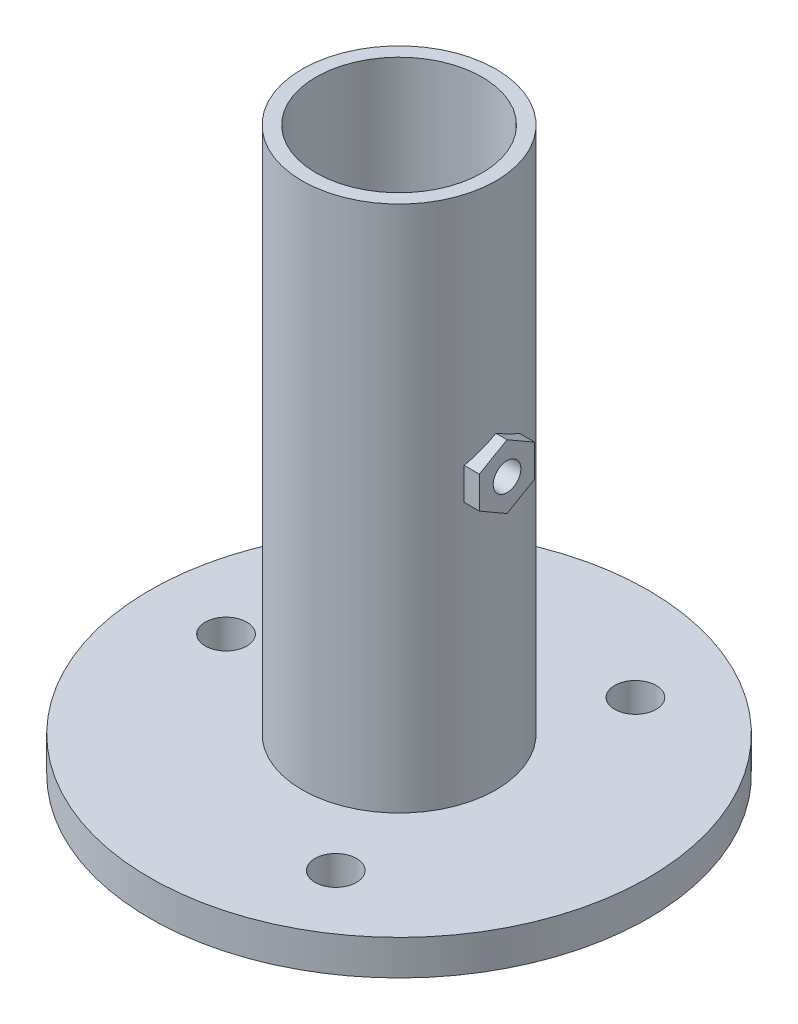
from build123d import *

# Parameters (mm, degrees)
SKETCH2_R                = 17.5
BOSS_EXTRUDE2_DEPTH      = 101.6
SKETCH3_R                = 45
BOSS_EXTRUDE3_DEPTH      = 6.35
SKETCH4_R                = 9
CUT_EXTRUDE1_DEPTH       = 95.25
SKETCH5_R                = 14.999999972
CUT_EXTRUDE2_DEPTH       = 96.6
SKETCH6_R                = 2.5
CUT_EXTRUDE3_DEPTH       = 120.885612148
BOSS_EXTRUDE4_DEPTH      = 5
BOSS_EXTRUDE4_DEPTH_BACK = 2
SKETCH8_R                = 2.5
SKETCH9_R                = 3.75
CUT_EXTRUDE4_DEPTH       = 115.553753758
CIRPATTERN1_COUNT        = 3


with BuildPart() as part:
    # Sketch2 → Boss-Extrude2 (new body)
    with BuildSketch(Plane(origin=(0, 0, 0), x_dir=(1, 0, 0), z_dir=(0, 1, 0))):
        with Locations(Location((0, 0, 0), (0, 0, 270))):
            Circle(SKETCH2_R)
    extrude(amount=BOSS_EXTRUDE2_DEPTH)

    # Sketch3 → Boss-Extrude3 (add)
    with BuildSketch(Plane(origin=(0, 0, 0), x_dir=(-1, 0, 0), z_dir=(0, -1, 0))):
        with Locations(Location((0, 0, 0), (0, 0, 90))):
            Circle(SKETCH3_R)
    extrude(amount=-BOSS_EXTRUDE3_DEPTH)

    # Sketch4 → Cut-Extrude1 (cut)
    with BuildSketch(Plane(origin=(0, 0, 0), x_dir=(-1, 0, 0), z_dir=(0, -1, 0))):
        with Locations(Location((0, 0, 0), (0, 0, 90))):
            Circle(SKETCH4_R)
    extrude(amount=-CUT_EXTRUDE1_DEPTH, mode=Mode.SUBTRACT)

    # Sketch5 → Cut-Extrude2 (cut)
    with BuildSketch(Plane(origin=(0, 101.6, 0), x_dir=(1, 0, 0), z_dir=(0, 1, 0))):
        with Locations(Location((0, 0, 0), (0, 0, 270))):
            Circle(SKETCH5_R)
    extrude(amount=-CUT_EXTRUDE2_DEPTH, mode=Mode.SUBTRACT)

    # Sketch6 → Cut-Extrude3 (cut, through all)
    with BuildSketch(Plane(origin=(0, 0, 0), x_dir=(0, 0, -1), z_dir=(1, 0, 0))):
        with Locations(Location((0, 56.35, 0), (0, 0, 180))):
            Circle(SKETCH6_R)
    extrude(amount=CUT_EXTRUDE3_DEPTH, mode=Mode.SUBTRACT)

    # Sketch8 → Boss-Extrude4 (add, two sides: drawn at the far end of the back side and taken through both)
    with BuildSketch(Plane.ZY.offset(-17.5).offset(-BOSS_EXTRUDE4_DEPTH_BACK)):
        Polygon((-5, 53.463248654), (0, 50.576497308), (5, 53.463248654), (5, 59.236751346), (0, 62.123502692), (-5, 59.236751346), align=None)
        with Locations((0, 56.35)):
            Circle(SKETCH8_R, mode=Mode.SUBTRACT)
    extrude(amount=BOSS_EXTRUDE4_DEPTH + BOSS_EXTRUDE4_DEPTH_BACK)

    # Sketch9 → Cut-Extrude4 (cut, through all)
    with BuildSketch(Plane(origin=(0, 6.35, 0), x_dir=(1, 0, 0), z_dir=(0, 1, 0))):
        with Locations(Location((-31.25, 0, 0), (0, 0, 270))):
            Circle(SKETCH9_R)
    cut_extrude4 = extrude(amount=-CUT_EXTRUDE4_DEPTH, mode=Mode.SUBTRACT)

    # CirPattern1: Cut-Extrude4 ×3 about axis
    cirpattern1_axis = Axis((0, 0, 0), (0, 1, 0))
    for i in range(1, CIRPATTERN1_COUNT):
        add(cut_extrude4.rotate(cirpattern1_axis, i * 360 / CIRPATTERN1_COUNT), mode=Mode.SUBTRACT)


solid = part.part
